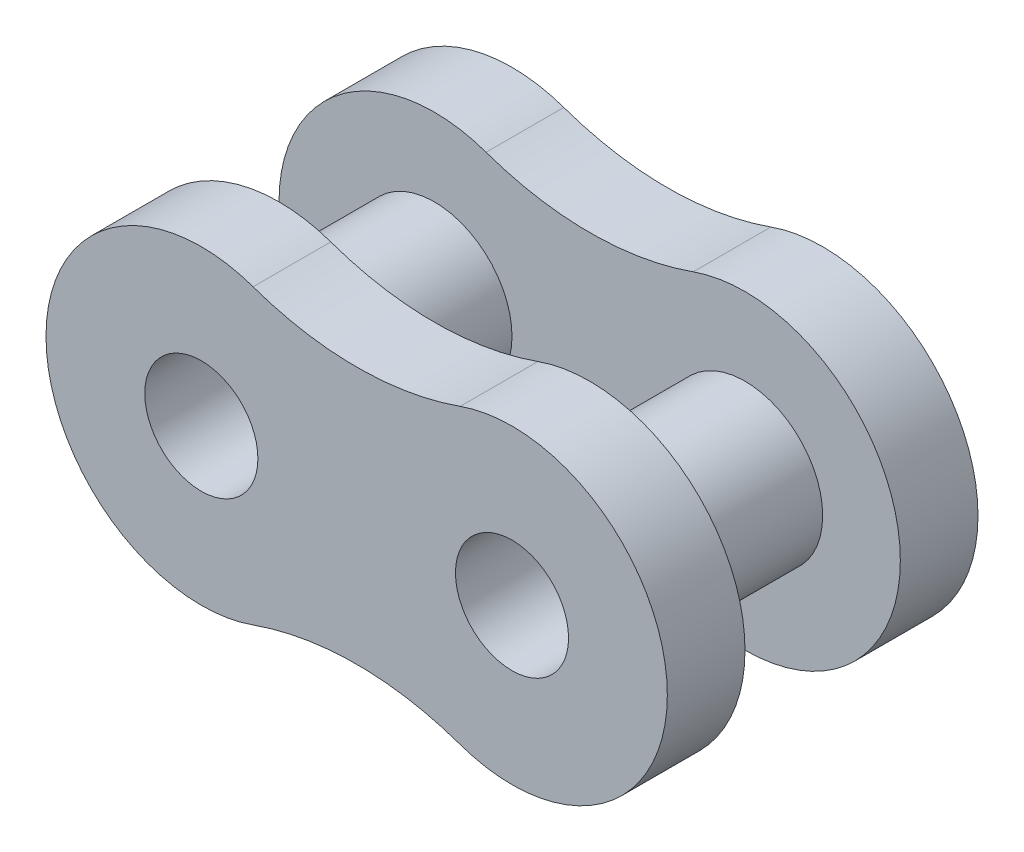
from build123d import *
from build123d.topology import SkipClean

# Parameters (mm, degrees)
SKETCH1_R           = 1.1557
BOSS_EXTRUDE1_DEPTH = 1.5875
BOSS_EXTRUDE2_START = -3.175
SKETCH1_3_R         = 1.5875
SKETCH1_3_R_2       = 1.1557
BOSS_EXTRUDE2_DEPTH = 3.175
BOSS_EXTRUDE3_START = 1.5875
SKETCH2_R           = 1.1557
BOSS_EXTRUDE3_DEPTH = 1.5875


with BuildPart() as part:
    # Sketch1 → Boss-Extrude1 (new body)
    with BuildSketch(Plane.XY):
        with BuildLine():
            ThreePointArc((1.058333333, 2.993418707), (-3.175, 0), (1.058333333, -2.993418707))
            ThreePointArc((1.058333333, -2.993418707), (3.175, -2.630256121), (5.291666667, -2.993418707))
            ThreePointArc((5.291666667, -2.993418707), (9.525, 0), (5.291666667, 2.993418707))
            ThreePointArc((5.291666667, 2.993418707), (3.175, 2.630256121), (1.058333333, 2.993418707))
        make_face()
        Circle(SKETCH1_R, mode=Mode.SUBTRACT)
        with Locations((6.35, 0)):
            Circle(SKETCH1_R, mode=Mode.SUBTRACT)
    extrude(amount=BOSS_EXTRUDE1_DEPTH)

    # Sketch1<3> → Boss-Extrude2 (add)
    # profile 1 of 2: a face of its own
    with BuildSketch(Plane.XY.offset(BOSS_EXTRUDE2_START)):
        Circle(SKETCH1_3_R)
        Circle(SKETCH1_3_R_2, mode=Mode.SUBTRACT)
    # profile 2 of 2: a face of its own
    with BuildSketch(Plane.XY.offset(BOSS_EXTRUDE2_START)):
        with Locations((6.35, 0)):
            Circle(SKETCH1_3_R)
        with Locations((6.35, 0)):
            Circle(SKETCH1_3_R_2, mode=Mode.SUBTRACT)
    extrude(amount=BOSS_EXTRUDE2_DEPTH)

    # Sketch2 → Boss-Extrude3 (add)
    with SkipClean():  # the faces are left unmerged after this step: merging them gives an invalid solid
        with BuildSketch(Plane(origin=(0, 0, -3.175), x_dir=(-1, 0, 0), z_dir=(0, 0, -1)).offset(BOSS_EXTRUDE3_START)):
            with BuildLine():
                ThreePointArc((-1.058333333, 2.993418707), (3.175, 0), (-1.058333333, -2.993418707))
                ThreePointArc((-1.058333333, -2.993418707), (-3.175, -2.630256121), (-5.291666667, -2.993418707))
                ThreePointArc((-5.291666667, -2.993418707), (-9.525, 0), (-5.291666667, 2.993418707))
                ThreePointArc((-5.291666667, 2.993418707), (-3.175, 2.630256121), (-1.058333333, 2.993418707))
            make_face()
            with Locations((-6.35, 0)):
                Circle(SKETCH2_R, mode=Mode.SUBTRACT)
            Circle(SKETCH2_R, mode=Mode.SUBTRACT)
        extrude(amount=-BOSS_EXTRUDE3_DEPTH)


solid = part.part
